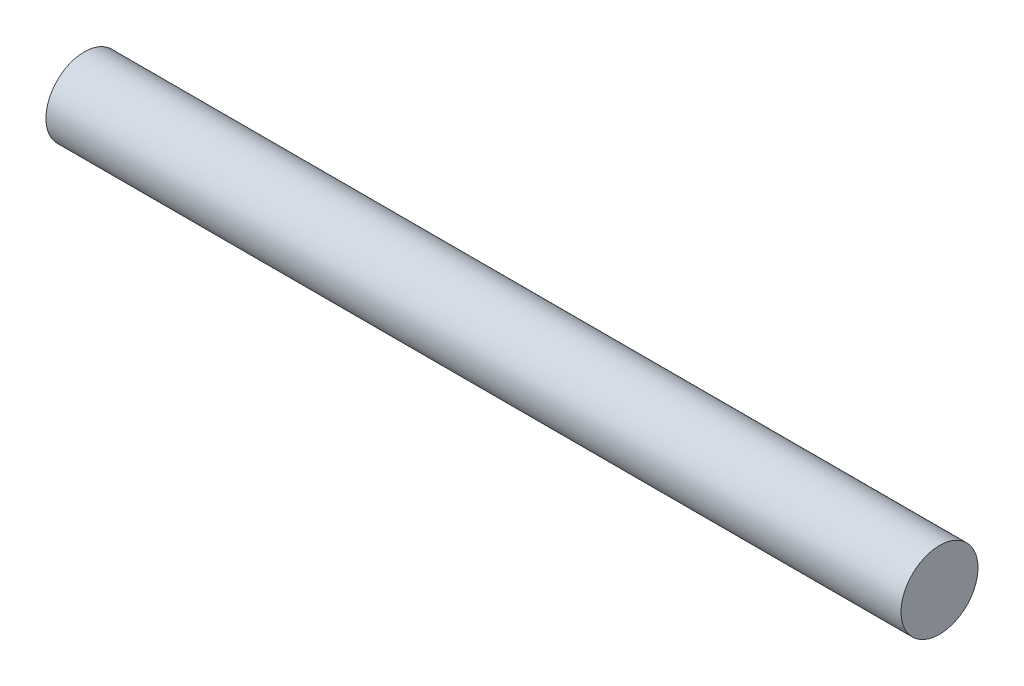
from build123d import *

# Parameters (mm, degrees)
SKETCH1_R           = 45
BOSS_EXTRUDE1_DEPTH = 1000


with BuildPart() as part:
    # Sketch1 → Boss-Extrude1 (new body)
    with BuildSketch(Plane(origin=(0, 0, 0), x_dir=(0, 0, -1), z_dir=(1, 0, 0))):
        Circle(SKETCH1_R)
    extrude(amount=BOSS_EXTRUDE1_DEPTH)


solid = part.part
